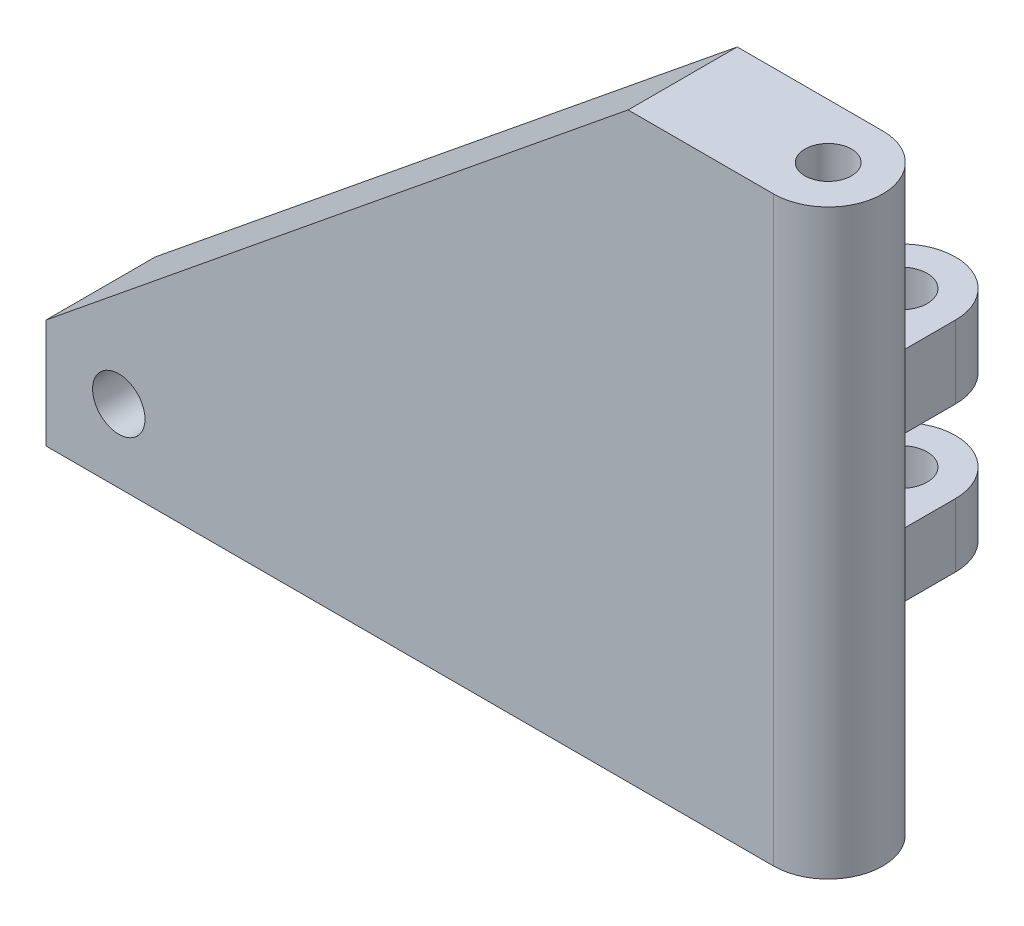
from build123d import *

# Parameters (mm, degrees)
SKETCH1_R           = 2.032
BOSS_EXTRUDE1_DEPTH = 25.4
SKETCH5_R           = 2.286
BOSS_EXTRUDE2_DEPTH = 19.05
SKETCH2_R           = 2.286
CUT_EXTRUDE1_DEPTH  = 77.793005053
CUT_EXTRUDE2_START  = 5.55625
CUT_EXTRUDE2_DEPTH  = 7.14375
CUT_EXTRUDE3_DEPTH  = 73.955945611


with BuildPart() as part:
    # Sketch1 → Boss-Extrude1 (new, symmetric)
    with BuildSketch(Plane(origin=(0, 0, 0), x_dir=(1, 0, 0), z_dir=(0, 1, 0))):
        with BuildLine():
            Line((0, 4.7625), (-63.5, 4.7625))
            Line((-63.5, 4.7625), (-63.5, -4.7625))
            Line((-63.5, -4.7625), (0, -4.7625))
            ThreePointArc((0, -4.7625), (4.7625, 0), (0, 4.7625))
        make_face()
        with Locations(Location((0, 0, 0), (0, 0, 270))):
            Circle(SKETCH1_R, mode=Mode.SUBTRACT)
    extrude(amount=BOSS_EXTRUDE1_DEPTH, both=True)

    # Sketch5 → Boss-Extrude2 (add)
    with BuildSketch(Plane(origin=(0, -25.4, 0), x_dir=(1, 0, 0), z_dir=(0, 1, 0))):
        with BuildLine():
            Line((-23.8125, 25.4), (-23.8125, 4.7625))
            Line((-23.8125, 4.7625), (-14.2875, 4.7625))
            Line((-14.2875, 4.7625), (-14.2875, 25.4))
            ThreePointArc((-14.2875, 25.4), (-19.05, 30.1625), (-23.8125, 25.4))
        make_face()
        with Locations(Location((-19.05, 25.4, 0), (0, 0, 90))):
            Circle(SKETCH5_R, mode=Mode.SUBTRACT)
    extrude(amount=BOSS_EXTRUDE2_DEPTH)

    # Sketch2 → Cut-Extrude1 (cut, through all)
    with BuildSketch(Plane.XY.offset(4.7625)):
        with Locations((-57.15, -19.05)):
            Circle(SKETCH2_R)
    extrude(amount=-CUT_EXTRUDE1_DEPTH, mode=Mode.SUBTRACT)

    # Sketch3 → Cut-Extrude2 (cut)
    with BuildSketch(Plane(origin=(0, -25.4, 0), x_dir=(1, 0, 0), z_dir=(0, 1, 0)).offset(CUT_EXTRUDE2_START)):
        with BuildLine():
            Line((-22.225, 19.900738686), (-14.2875, 15.318020924))
            Line((-14.2875, 15.318020924), (-14.2875, 25.4))
            ThreePointArc((-14.2875, 25.4), (-19.05, 30.1625), (-23.8125, 25.4))
            Line((-23.8125, 25.4), (-23.8125, 21.199869794))
            ThreePointArc((-23.8125, 21.199869794), (-23.071555914, 20.485776966), (-22.225, 19.900738686))
        make_face()
    extrude(amount=CUT_EXTRUDE2_DEPTH, mode=Mode.SUBTRACT)

    # Sketch4 → Cut-Extrude3 (cut, through all)
    with BuildSketch(Plane(origin=(0, 0, -4.7625), x_dir=(-1, 0, 0), z_dir=(0, 0, -1))):
        Polygon((12.7, 25.4), (63.5, -15.875), (63.5, 25.4), align=None)
    extrude(amount=-CUT_EXTRUDE3_DEPTH, mode=Mode.SUBTRACT)


solid = part.part
